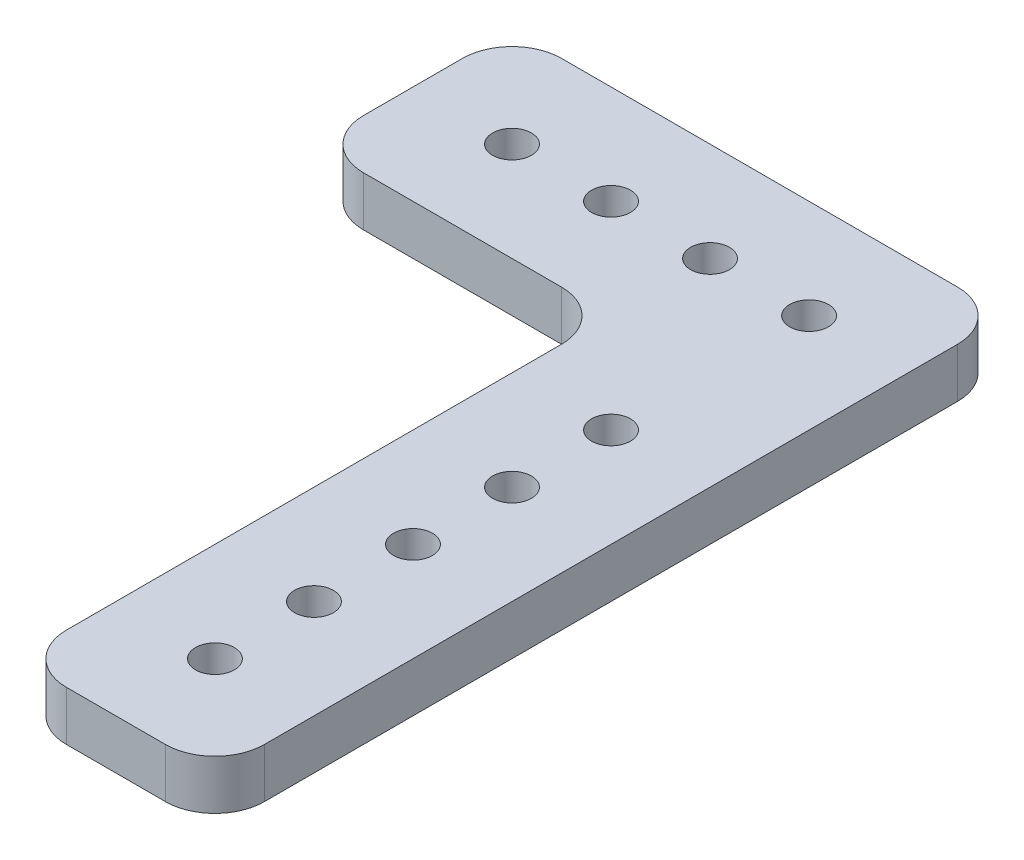
from build123d import *

# Parameters (mm, degrees)
SKETCH1_R           = 2.4892
SKETCH1_W           = 25.4
SKETCH1_H           = 76.2
BOSS_EXTRUDE1_DEPTH = 6.35
FILLET1_R           = 6.35


with BuildPart() as part:
    # Sketch1 → Boss-Extrude1 (new body)
    # profile 1 of 3: a face of its own
    with BuildSketch(Plane(origin=(0, 0, 0), x_dir=(1, 0, 0), z_dir=(0, 1, 0))):
        with BuildLine():
            Line((-38.1, 76.2), (0, 76.2))
            Line((0, 76.2), (0, 86.4108))
            ThreePointArc((0, 86.4108), (-2.4892, 88.9), (0, 91.3892))
            Line((0, 91.3892), (0, 101.6))
            Line((0, 101.6), (-38.1, 101.6))
            Line((-38.1, 101.6), (-38.1, 76.2))
        make_face()
        with Locations(Location((-25.4, 88.9, 0), (0, 0, 270))):
            Circle(SKETCH1_R, mode=Mode.SUBTRACT)
        with Locations(Location((-12.7, 88.9, 0), (0, 0, 270))):
            Circle(SKETCH1_R, mode=Mode.SUBTRACT)
    # profile 2 of 3: a face of its own
    with BuildSketch(Plane(origin=(0, 0, 0), x_dir=(1, 0, 0), z_dir=(0, 1, 0))):
        with BuildLine():
            Line((0, 86.4108), (0, 76.2))
            Line((0, 76.2), (25.4, 76.2))
            Line((25.4, 76.2), (25.4, 101.6))
            Line((25.4, 101.6), (0, 101.6))
            Line((0, 101.6), (0, 91.3892))
            ThreePointArc((0, 91.3892), (1.7601302, 90.6601302), (2.4892, 88.9))
            ThreePointArc((2.4892, 88.9), (1.7601302, 87.1398698), (0, 86.4108))
        make_face()
        with Locations(Location((12.7, 88.9, 0), (0, 0, 270))):
            Circle(SKETCH1_R, mode=Mode.SUBTRACT)
    # profile 3 of 3: a face of its own
    with BuildSketch(Plane(origin=(0, 0, 0), x_dir=(1, 0, 0), z_dir=(0, 1, 0))):
        with Locations((12.7, 38.1)):
            Rectangle(SKETCH1_W, SKETCH1_H)
        with Locations(Location((12.7, 12.7, 0), (0, 0, 270))):
            Circle(SKETCH1_R, mode=Mode.SUBTRACT)
        with Locations(Location((12.7, 25.4, 0), (0, 0, 270))):
            Circle(SKETCH1_R, mode=Mode.SUBTRACT)
        with Locations(Location((12.7, 38.1, 0), (0, 0, 270))):
            Circle(SKETCH1_R, mode=Mode.SUBTRACT)
        with Locations(Location((12.7, 50.8, 0), (0, 0, 270))):
            Circle(SKETCH1_R, mode=Mode.SUBTRACT)
        with Locations(Location((12.7, 63.5, 0), (0, 0, 270))):
            Circle(SKETCH1_R, mode=Mode.SUBTRACT)
    extrude(amount=BOSS_EXTRUDE1_DEPTH)

    # Fillet1
    fillet1_edges = [part.edges().sort_by_distance(p)[0] for p in [
        (25.4, 3.175, 0),
        (0, 3.175, 0),
        (0, 3.175, -76.2),
        (-38.1, 3.175, -76.2),
        (-38.1, 3.175, -101.6),
        (25.4, 3.175, -101.6),
    ]]
    fillet(fillet1_edges, radius=FILLET1_R)


solid = part.part
